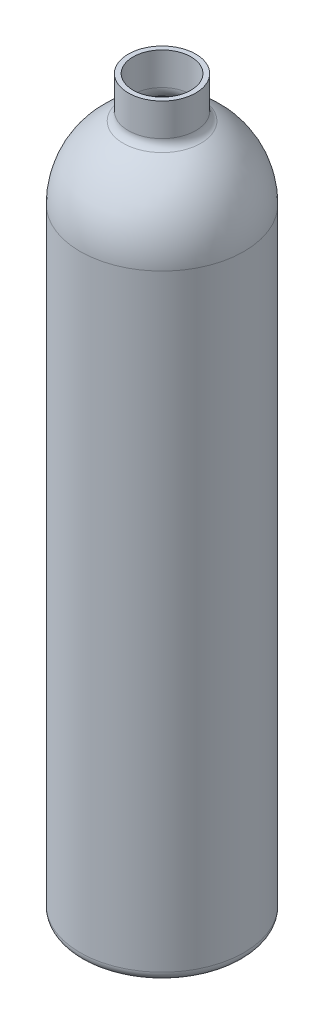
from build123d import *

# Parameters (mm, degrees)
SHELL2_T = -1.5875


with BuildPart() as part:
    # Sketch4 → Revolve2 (revolve)
    with BuildSketch(Plane(origin=(0, 0, 0), x_dir=(0, 0, -1), z_dir=(1, 0, 0))):
        with BuildLine():
            Line((0, 0), (23.8125, 0))
            ThreePointArc((23.8125, 0), (26.05756403, 0.92993597), (26.9875, 3.175))
            Line((26.9875, 3.175), (26.9875, 203.2))
            ThreePointArc((26.9875, 203.2), (23.165937094, 217.044295388), (12.783552632, 226.967749964))
            ThreePointArc((12.783552632, 226.967749964), (11.562095636, 228.135215209), (11.1125, 229.763955842))
            Line((11.1125, 229.763955842), (11.1125, 240.493444248))
            Line((11.1125, 240.493444248), (0, 240.493444248))
            Line((0, 240.493444248), (0, 0))
        make_face()
    revolve(axis=Axis((0, 0, 0), (0, 1, 0)))

    # Shell2
    shell2_openings = [part.faces().sort_by_distance(p)[0] for p in [
        (0, 240.493444248, 0),
    ]]
    offset(amount=SHELL2_T, openings=shell2_openings, kind=Kind.INTERSECTION)


solid = part.part
